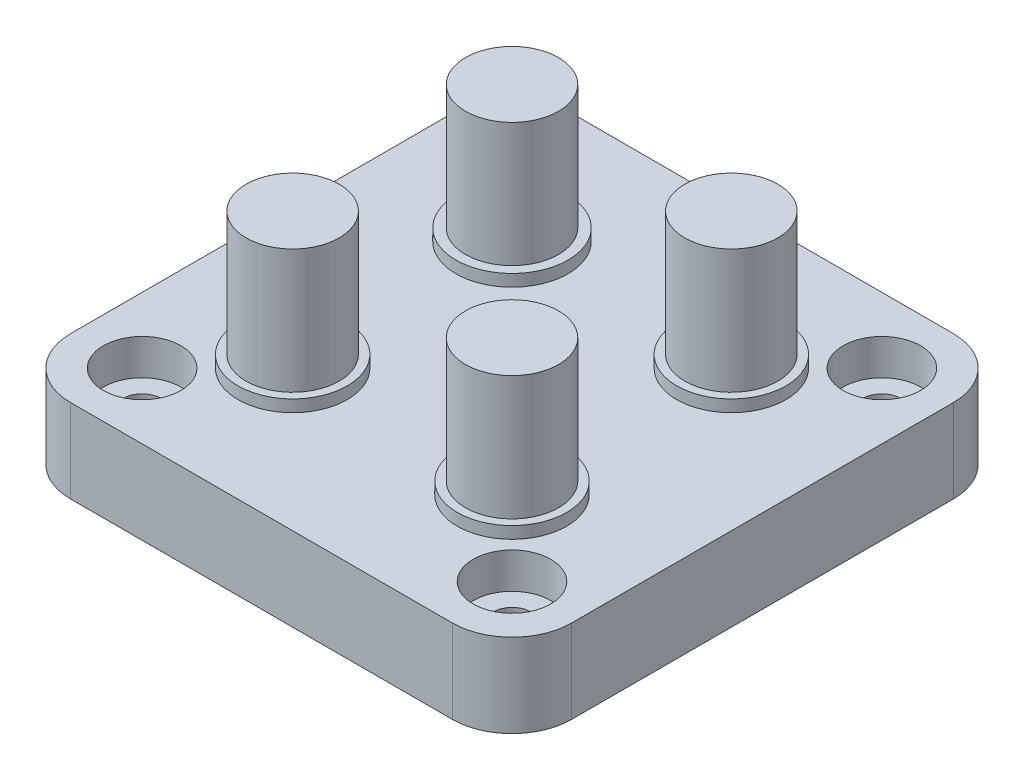
from build123d import *

# Parameters (mm, degrees)
SKIZZE1_W                       = 42
SKIZZE1_H                       = 42
SKIZZE1_R                       = 1.6
SKIZZE1_R_2                     = 3.5
AUFSATZ_LINEAR_AUSTRAGEN1_DEPTH = 7
SKIZZE2_R                       = 3.9
AUFSATZ_LINEAR_AUSTRAGEN2_DEPTH = 11.4
VERRUNDUNG1_R                   = 5
SKIZZE3_R                       = 12
SCHNITT_LINEAR_AUSTRAGEN1_DEPTH = 3
SKIZZE4_R                       = 3.25
SCHNITT_LINEAR_AUSTRAGEN2_DEPTH = 3
SKIZZE5_R                       = 4.7
SKIZZE5_R_2                     = 4.580495264
AUFSATZ_LINEAR_AUSTRAGEN3_DEPTH = 1


with BuildPart() as part:
    # Skizze1 → Aufsatz-Linear austragen1 (new body)
    with BuildSketch(Plane(origin=(0, 0, 0), x_dir=(1, 0, 0), z_dir=(0, 1, 0))):
        with Locations((21, 21)):
            Rectangle(SKIZZE1_W, SKIZZE1_H)
        with Locations(Location((5.5, 36.5, 0), (0, 0, 270))):
            Circle(SKIZZE1_R, mode=Mode.SUBTRACT)
        with Locations(Location((36.5, 36.5, 0), (0, 0, 270))):
            Circle(SKIZZE1_R, mode=Mode.SUBTRACT)
        with Locations(Location((5.5, 5.5, 0), (0, 0, 270))):
            Circle(SKIZZE1_R, mode=Mode.SUBTRACT)
        with Locations(Location((36.5, 5.5, 0), (0, 0, 270))):
            Circle(SKIZZE1_R, mode=Mode.SUBTRACT)
        with Locations(Location((21, 21, 0), (0, 0, 270))):
            Circle(SKIZZE1_R_2, mode=Mode.SUBTRACT)
    extrude(amount=AUFSATZ_LINEAR_AUSTRAGEN1_DEPTH)

    # Skizze2 → Aufsatz-Linear austragen2 (add)
    with BuildSketch(Plane(origin=(0, 7, 0), x_dir=(1, 0, 0), z_dir=(0, 1, 0))):
        with Locations(Location((11.807611845, 30.192388155, 0), (0, 0, 90))):
            Circle(SKIZZE2_R)
        with Locations(Location((30.192388155, 30.192388155, 0), (0, 0, 90))):
            Circle(SKIZZE2_R)
        with Locations(Location((30.192388155, 11.807611845, 0), (0, 0, 90))):
            Circle(SKIZZE2_R)
        with Locations(Location((11.807611845, 11.807611845, 0), (0, 0, 90))):
            Circle(SKIZZE2_R)
    extrude(amount=AUFSATZ_LINEAR_AUSTRAGEN2_DEPTH)

    # Verrundung1
    verrundung1_edges = [part.edges().sort_by_distance(p)[0] for p in [
        (0, 3.5, -42),
        (42, 3.5, -42),
        (42, 3.5, 0),
        (0, 3.5, 0),
    ]]
    fillet(verrundung1_edges, radius=VERRUNDUNG1_R)

    # Skizze3 → Schnitt-Linear austragen1 (cut)
    with BuildSketch(Plane.XZ):
        with Locations(Location((21, -21, 0), (0, 0, 270))):
            Circle(SKIZZE3_R)
    extrude(amount=-SCHNITT_LINEAR_AUSTRAGEN1_DEPTH, mode=Mode.SUBTRACT)

    # Skizze4 → Schnitt-Linear austragen2 (cut)
    with BuildSketch(Plane(origin=(0, 7, 0), x_dir=(1, 0, 0), z_dir=(0, 1, 0))):
        with Locations(Location((5.5, 36.5, 0), (0, 0, 270))):
            Circle(SKIZZE4_R)
        with Locations(Location((36.5, 36.5, 0), (0, 0, 270))):
            Circle(SKIZZE4_R)
        with Locations(Location((5.5, 5.5, 0), (0, 0, 270))):
            Circle(SKIZZE4_R)
        with Locations(Location((36.5, 5.5, 0), (0, 0, 270))):
            Circle(SKIZZE4_R)
    extrude(amount=-SCHNITT_LINEAR_AUSTRAGEN2_DEPTH, mode=Mode.SUBTRACT)

    # Skizze5 → Aufsatz-Linear austragen3 (add)
    with BuildSketch(Plane(origin=(0, 7, 0), x_dir=(1, 0, 0), z_dir=(0, 1, 0))):
        with Locations(Location((11.807611845, 30.192388155, 0), (0, 0, 90))):
            Circle(SKIZZE5_R)
        with Locations(Location((11.807611845, 11.807611845, 0), (0, 0, 90))):
            Circle(SKIZZE5_R_2)
        with Locations(Location((30.192388155, 11.807611845, 0), (0, 0, 90))):
            Circle(SKIZZE5_R_2)
        with Locations(Location((30.192388155, 30.192388155, 0), (0, 0, 90))):
            Circle(SKIZZE5_R_2)
    extrude(amount=AUFSATZ_LINEAR_AUSTRAGEN3_DEPTH)


solid = part.part
